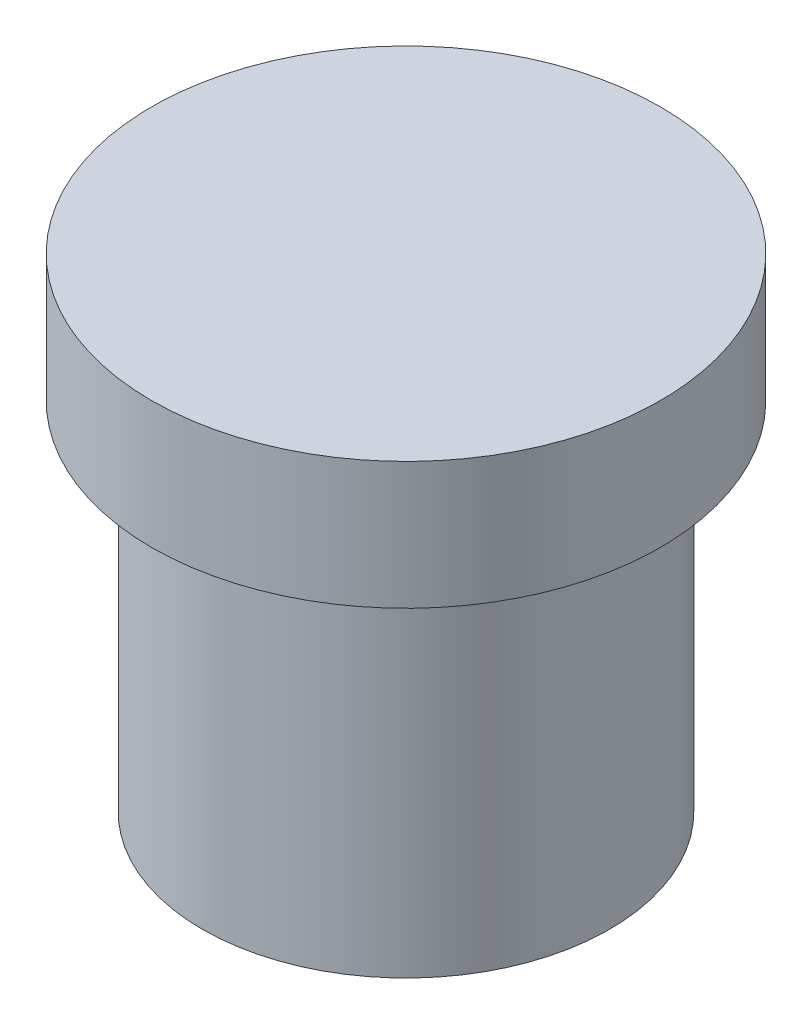
from build123d import *

# Parameters (mm, degrees)
SKETCH1_R           = 400
BOSS_EXTRUDE1_DEPTH = 700
SKETCH2_R           = 500
BOSS_EXTRUDE2_DEPTH = 250


with BuildPart() as part:
    # Sketch1 → Boss-Extrude1 (new body)
    with BuildSketch(Plane(origin=(0, 0, 0), x_dir=(1, 0, 0), z_dir=(0, 1, 0))):
        with Locations(Location((0, 0, 0), (0, 0, 270))):
            Circle(SKETCH1_R)
    extrude(amount=BOSS_EXTRUDE1_DEPTH)

    # Sketch2 → Boss-Extrude2 (add)
    with BuildSketch(Plane(origin=(0, 700, 0), x_dir=(1, 0, 0), z_dir=(0, 1, 0))):
        with Locations(Location((0, 0, 0), (0, 0, 270))):
            Circle(SKETCH2_R)
    extrude(amount=BOSS_EXTRUDE2_DEPTH)


solid = part.part
